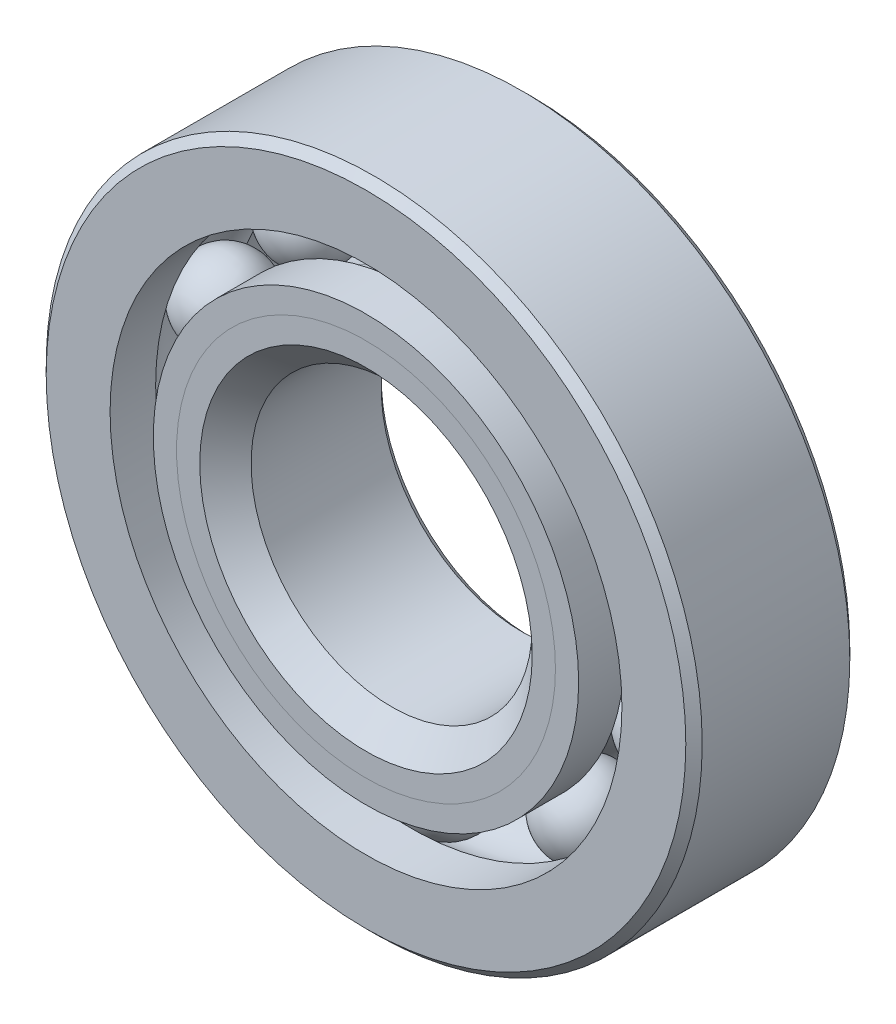
from build123d import *

# Parameters (mm, degrees)
CIRPATTERN1_COUNT = 10


with BuildPart() as part:
    # Sketch1 → Revolve1 (revolve)
    with BuildSketch(Plane(origin=(0, 0, 0), x_dir=(0, 0, -1), z_dir=(1, 0, 0))):
        with BuildLine():
            Line((2.5003125, 11.1125), (-2.5003125, 11.1125))
            Line((-2.5003125, 11.1125), (-2.778125, 10.8346875))
            Line((-2.778125, 10.8346875), (-2.778125, 8.670192308))
            Line((-2.778125, 8.670192308), (-1.234722222, 8.670192308))
            ThreePointArc((-1.234722222, 8.670192308), (0, 9.373249624), (1.234722222, 8.670192308))
            Line((1.234722222, 8.670192308), (2.778125, 8.670192308))
            Line((2.778125, 8.670192308), (2.778125, 10.8346875))
            Line((2.778125, 10.8346875), (2.5003125, 11.1125))
        make_face()
    revolve(axis=Axis((0, 0, 2.778125), (0, 0, -1)))


with BuildPart() as body_2:
    # Sketch2 → Revolve2 (revolve)
    with BuildSketch(Plane(origin=(0, 0, 0), x_dir=(0, 0, -1), z_dir=(1, 0, 0))):
        with BuildLine():
            Line((-2.778125, 7.204807692), (-1.234722222, 7.204807692))
            ThreePointArc((-1.234722222, 7.204807692), (-0.710427434, 6.689834242), (0, 6.501750376))
            Line((0, 6.501750376), (0, 5.632125188))
            Line((0, 5.632125188), (-1.991783748, 5.632125188))
            Line((-1.991783748, 5.632125188), (-2.778125, 6.41846644))
            Line((-2.778125, 6.41846644), (-2.778125, 7.204807692))
        make_face()
    revolve(axis=Axis((0, 0, 2.778125), (0, 0, -1)))


with BuildPart() as body_3:
    # Sketch3 → Revolve3 (revolve)
    with BuildSketch(Plane(origin=(0, 0, 0), x_dir=(0, 0, -1), z_dir=(1, 0, 0))):
        with BuildLine():
            Line((-2.778125, 6.41846644), (-1.991783748, 5.632125188))
            Line((-1.991783748, 5.632125188), (0, 5.632125188))
            Line((0, 5.632125188), (0, 6.501750376))
            ThreePointArc((0, 6.501750376), (0.710427434, 6.689834242), (1.234722222, 7.204807692))
            Line((1.234722222, 7.204807692), (2.778125, 7.204807692))
            Line((2.778125, 7.204807692), (2.778125, 5.0403125))
            Line((2.778125, 5.0403125), (2.5003125, 4.7625))
            Line((2.5003125, 4.7625), (-1.908499812, 4.7625))
            Line((-1.908499812, 4.7625), (-2.778125, 5.632125188))
            Line((-2.778125, 5.632125188), (-2.778125, 6.41846644))
        make_face()
    revolve(axis=Axis((0, 0, 2.778125), (0, 0, -1)))


with BuildPart() as body_4:
    # Sketch4 → Revolve4 (revolve)
    with BuildSketch(Plane(origin=(0, 0, 0), x_dir=(0, 0, -1), z_dir=(1, 0, 0))):
        with BuildLine():
            Line((-1.435749624, 7.9375), (1.435749624, 7.9375))
            ThreePointArc((1.435749624, 7.9375), (0, 9.373249624), (-1.435749624, 7.9375))
        make_face()
    revolve(axis=Axis((0, 7.9375, 1.435749624), (0, 0, -1)))


with BuildPart() as cirpattern1_1:
    # CirPattern1: pattern copy
    add(body_4.part.rotate(Axis((0, 0, -2.778125), (0, 0, 1)), 1 * 360 / CIRPATTERN1_COUNT))


with BuildPart() as cirpattern1_2:
    # CirPattern1: pattern copy
    add(body_4.part.rotate(Axis((0, 0, -2.778125), (0, 0, 1)), 2 * 360 / CIRPATTERN1_COUNT))


with BuildPart() as cirpattern1_3:
    # CirPattern1: pattern copy
    add(body_4.part.rotate(Axis((0, 0, -2.778125), (0, 0, 1)), 3 * 360 / CIRPATTERN1_COUNT))


with BuildPart() as cirpattern1_4:
    # CirPattern1: pattern copy
    add(body_4.part.rotate(Axis((0, 0, -2.778125), (0, 0, 1)), 4 * 360 / CIRPATTERN1_COUNT))


with BuildPart() as cirpattern1_5:
    # CirPattern1: pattern copy
    add(body_4.part.rotate(Axis((0, 0, -2.778125), (0, 0, 1)), 5 * 360 / CIRPATTERN1_COUNT))


with BuildPart() as cirpattern1_6:
    # CirPattern1: pattern copy
    add(body_4.part.rotate(Axis((0, 0, -2.778125), (0, 0, 1)), 6 * 360 / CIRPATTERN1_COUNT))


with BuildPart() as cirpattern1_7:
    # CirPattern1: pattern copy
    add(body_4.part.rotate(Axis((0, 0, -2.778125), (0, 0, 1)), 7 * 360 / CIRPATTERN1_COUNT))


with BuildPart() as cirpattern1_8:
    # CirPattern1: pattern copy
    add(body_4.part.rotate(Axis((0, 0, -2.778125), (0, 0, 1)), 8 * 360 / CIRPATTERN1_COUNT))


with BuildPart() as cirpattern1_9:
    # CirPattern1: pattern copy
    add(body_4.part.rotate(Axis((0, 0, -2.778125), (0, 0, 1)), 9 * 360 / CIRPATTERN1_COUNT))


solid = Compound([part.part, body_2.part, body_3.part, body_4.part, cirpattern1_1.part, cirpattern1_2.part, cirpattern1_3.part, cirpattern1_4.part, cirpattern1_5.part, cirpattern1_6.part, cirpattern1_7.part, cirpattern1_8.part, cirpattern1_9.part])
